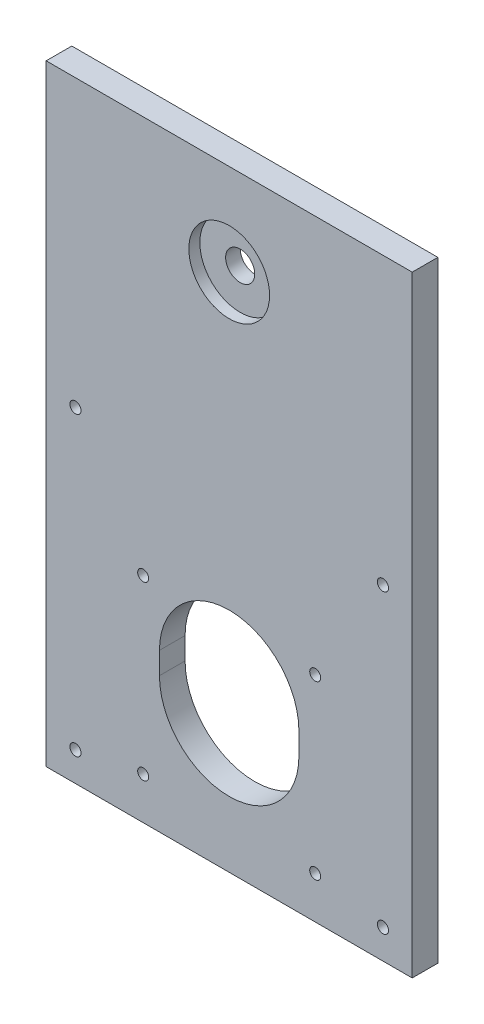
from build123d import *

# Parameters (mm, degrees)
SKETCH1_W           = 100
SKETCH1_H           = 247
SKETCH1_R           = 1.525
SKETCH1_R_2         = 3.975
SKETCH1_R_3         = 1.5
BOSS_EXTRUDE1_DEPTH = 7
SKETCH2_R           = 11.025
CUT_EXTRUDE1_DEPTH  = 3
SKETCH4_W           = 100
SKETCH4_H           = 80
CUT_EXTRUDE3_DEPTH  = 134.421325132


with BuildPart() as part:
    # Sketch1 → Boss-Extrude1 (new body)
    with BuildSketch(Plane.XY):
        Rectangle(SKETCH1_W, SKETCH1_H)
        with Locations((-42, -34.5)):
            Circle(SKETCH1_R, mode=Mode.SUBTRACT)
        with Locations((42, -34.5)):
            Circle(SKETCH1_R, mode=Mode.SUBTRACT)
        with Locations((-42, -115.5)):
            Circle(SKETCH1_R, mode=Mode.SUBTRACT)
        with Locations((42, -115.5)):
            Circle(SKETCH1_R, mode=Mode.SUBTRACT)
        with Locations((0, 18.5)):
            Circle(SKETCH1_R_2, mode=Mode.SUBTRACT)
        with Locations((42, 115.5)):
            Circle(SKETCH1_R, mode=Mode.SUBTRACT)
        with Locations((-42, 115.5)):
            Circle(SKETCH1_R, mode=Mode.SUBTRACT)
        with Locations((-23.5, -65)):
            Circle(SKETCH1_R_3, mode=Mode.SUBTRACT)
        with Locations((-23.5, -112)):
            Circle(SKETCH1_R_3, mode=Mode.SUBTRACT)
        with Locations((23.5, -112)):
            Circle(SKETCH1_R_3, mode=Mode.SUBTRACT)
        with Locations((23.5, -65)):
            Circle(SKETCH1_R_3, mode=Mode.SUBTRACT)
        with BuildLine():
            Line((-19.05, -80.5), (-19.05, -86.5))
            ThreePointArc((-19.05, -86.5), (0, -105.55), (19.05, -86.5))
            Line((19.05, -86.5), (19.05, -80.5))
            ThreePointArc((19.05, -80.5), (0, -61.45), (-19.05, -80.5))
        make_face(mode=Mode.SUBTRACT)
    extrude(amount=BOSS_EXTRUDE1_DEPTH)

    # Sketch2 → Cut-Extrude1 (cut)
    with BuildSketch(Plane.XY.offset(7)):
        with Locations((0, 18.5)):
            Circle(SKETCH2_R)
    extrude(amount=-CUT_EXTRUDE1_DEPTH, mode=Mode.SUBTRACT)

    # Sketch4 → Cut-Extrude3 (cut, through all)
    with BuildSketch(Plane.XY.offset(7)):
        with Locations((0, 83.5)):
            Rectangle(SKETCH4_W, SKETCH4_H)
    extrude(amount=-CUT_EXTRUDE3_DEPTH, mode=Mode.SUBTRACT)


solid = part.part
